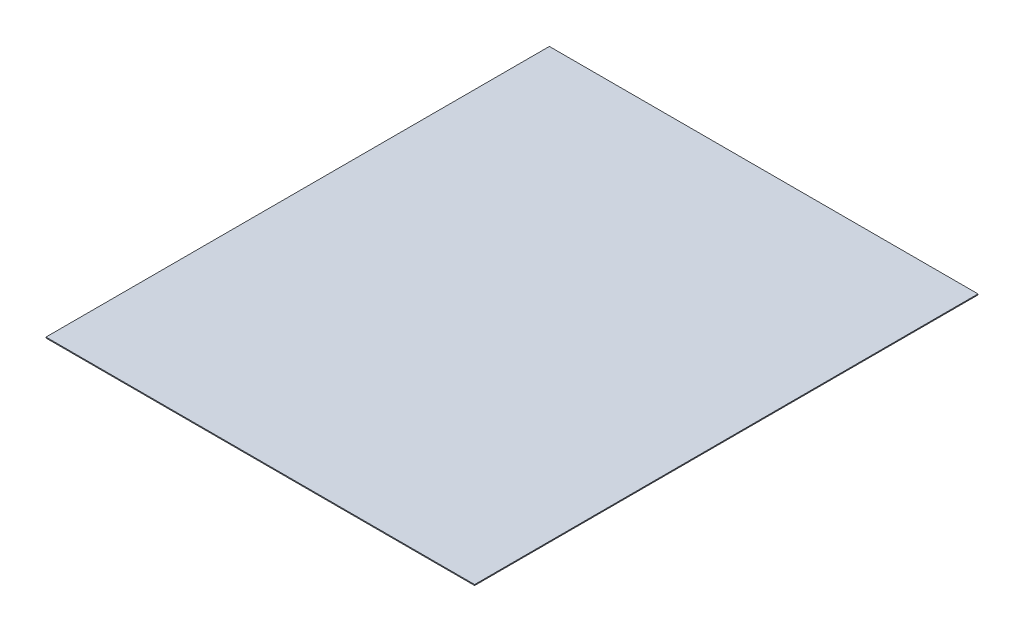
from build123d import *

# Parameters (mm, degrees)
SKETCH1_W             = 697
SKETCH1_H             = 1.5
PRESS_DIS_ALT_1_DEPTH = 818.5


with BuildPart() as part:
    # Sketch1 → PRESS_dis_alt_1 (new body)
    with BuildSketch(Plane.XY):
        with Locations((350, 120.75)):
            Rectangle(SKETCH1_W, SKETCH1_H)
    extrude(amount=-PRESS_DIS_ALT_1_DEPTH)


solid = part.part
